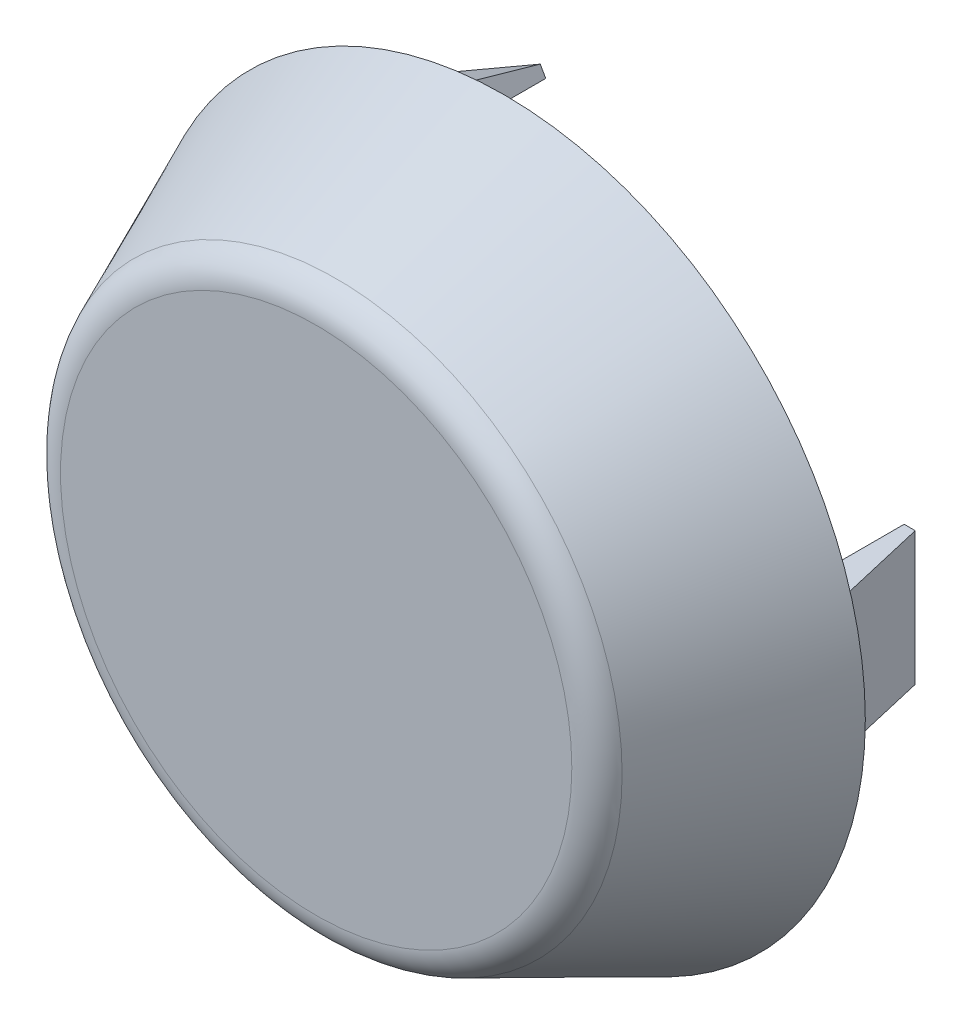
from build123d import *

# Parameters (mm, degrees)
TOP_R              = 12.5
MIDDLE_R           = 16.25
INSIDE_TOP_R       = 11.25
INSIDE_BOTTOM_R    = 15
ZAOKR_GLENIE1_R    = 1
ZAOKR_GLENIE2_R    = 1.5
LATCH_START        = -9
LATCH_DEPTH        = 9.75
LATCH_CUTOUT_DEPTH = 6
SZYK_KO_OWY2_COUNT = 3


with BuildPart() as part:
    # top → outside section 0
    with BuildSketch(Plane.XY):
        Circle(TOP_R)
    # middle → outside section 1
    with BuildSketch(Plane.XY.offset(-8.5)):
        Circle(MIDDLE_R)
    loft()

    # inside-top → inside-cutout section 0
    with BuildSketch(Plane.XY.offset(-1.5)):
        Circle(INSIDE_TOP_R)
    # inside-bottom → inside-cutout section 1
    with BuildSketch(Plane.XY.offset(-8.5)):
        Circle(INSIDE_BOTTOM_R)
    loft(mode=Mode.SUBTRACT)

    # Zaokrąglenie1
    zaokr_glenie1_edges = [part.edges().sort_by_distance(p)[0] for p in [
        (-11.25, 0, -1.5),
    ]]
    fillet(zaokr_glenie1_edges, radius=ZAOKR_GLENIE1_R)

    # Zaokrąglenie2
    zaokr_glenie2_edges = [part.edges().sort_by_distance(p)[0] for p in [
        (-12.5, 0, 0),
    ]]
    fillet(zaokr_glenie2_edges, radius=ZAOKR_GLENIE2_R)

    # Szkic6 → latch (add)
    with BuildSketch(Plane.XY.offset(-5).offset(LATCH_START)):
        Polygon((12.5, 0), (12.5, -3), (14, -3), (14, 3), (12.5, 3), align=None)
    latch = extrude(amount=LATCH_DEPTH)

    # Szkic → latch-cutout (cut)
    with BuildSketch(Plane(origin=(0, -3, 0), x_dir=(-1, 0, 0), z_dir=(0, -1, 0))):
        Polygon((-14, 9.7), (-13, 9.7), (-13, 8.2), (-14, 8.2), (-14.5, 8.2), (-14.5, 14), (-14, 14), (-13, 14), align=None)
    latch_cutout = extrude(amount=-LATCH_CUTOUT_DEPTH, mode=Mode.SUBTRACT)

    # Szyk kołowy2: latch, latch-cutout ×3 about axis
    szyk_ko_owy2_axis = Axis((0, 0, 0), (0, 0, 1))
    add([latch.rotate(szyk_ko_owy2_axis, i * 360 / SZYK_KO_OWY2_COUNT) for i in range(1, SZYK_KO_OWY2_COUNT)])
    add([latch_cutout.rotate(szyk_ko_owy2_axis, i * 360 / SZYK_KO_OWY2_COUNT) for i in range(1, SZYK_KO_OWY2_COUNT)], mode=Mode.SUBTRACT)


solid = part.part
